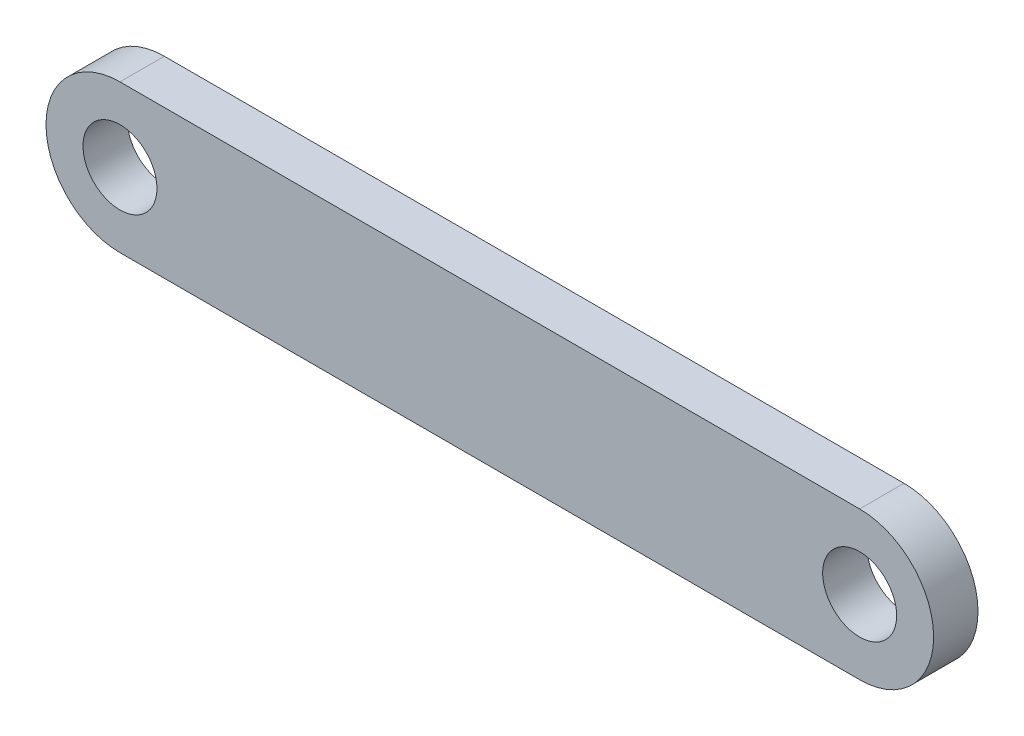
from build123d import *

# Parameters (mm, degrees)
BOSS_EXTRUDE1_DEPTH = 1.5
SKETCH2_R           = 2.5
CUT_EXTRUDE1_DEPTH  = 31.56141358


with BuildPart() as part:
    # Sketch1 → Boss-Extrude1 (new, symmetric)
    with BuildSketch(Plane.XY):
        with BuildLine():
            Line((-25, 5), (25, 5))
            ThreePointArc((25, 5), (30, 0), (25, -5))
            Line((25, -5), (-25, -5))
            ThreePointArc((-25, -5), (-30, 0), (-25, 5))
        make_face()
    extrude(amount=BOSS_EXTRUDE1_DEPTH, both=True)

    # Sketch2 → Cut-Extrude1 (cut, through all)
    with BuildSketch(Plane.XY.offset(1.5)):
        with Locations((-25, 0)):
            Circle(SKETCH2_R)
        with Locations((25, 0)):
            Circle(SKETCH2_R)
    extrude(amount=-CUT_EXTRUDE1_DEPTH, mode=Mode.SUBTRACT)


solid = part.part
